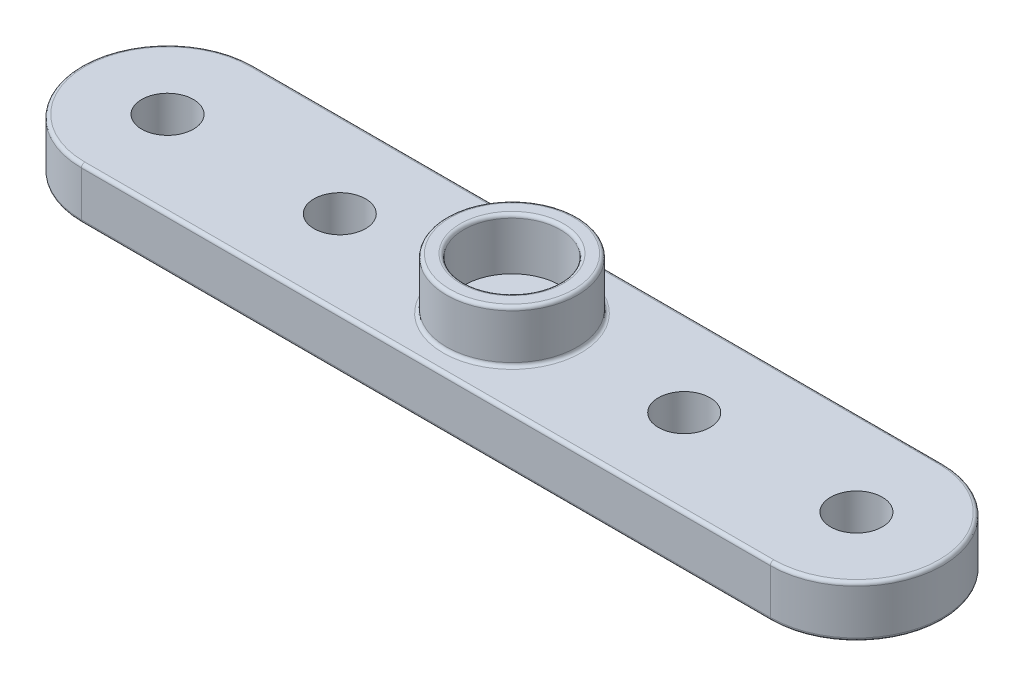
from build123d import *

# Parameters (mm, degrees)
SKETCH1_W           = 50
SKETCH1_H           = 10
SKETCH1_R           = 1.5
BOSS_EXTRUDE1_DEPTH = 3
FILLET2_RADIUS      = 5
FILLET2_LENGTH      = 3
FILLET3_RADIUS      = 5
FILLET3_LENGTH      = 3
SKETCH2_R           = 3.8
SKETCH2_R_2         = 2.8
BOSS_EXTRUDE2_DEPTH = 3
FILLET4_R           = 0.2


with BuildPart() as part:
    # Sketch1 → Boss-Extrude1 (new body)
    with BuildSketch(Plane(origin=(0, 0, 0), x_dir=(1, 0, 0), z_dir=(0, 1, 0))):
        Rectangle(SKETCH1_W, SKETCH1_H)
        with Locations(Location((-20, 0, 0), (0, 0, 270))):
            Circle(SKETCH1_R, mode=Mode.SUBTRACT)
        with Locations(Location((-10, 0, 0), (0, 0, 270))):
            Circle(SKETCH1_R, mode=Mode.SUBTRACT)
        with Locations(Location((10, 0, 0), (0, 0, 90))):
            Circle(SKETCH1_R, mode=Mode.SUBTRACT)
        with Locations(Location((20, 0, 0), (0, 0, 90))):
            Circle(SKETCH1_R, mode=Mode.SUBTRACT)
    extrude(amount=BOSS_EXTRUDE1_DEPTH)

    # Fillet2: full round fillet: the end face becomes a half cylinder, R = half its width
    fillet2_face = Plane((-25, 1.5, 0), x_dir=(0, -1, 0), z_dir=(-1, 0, 0))  # on the end face: x along it, z out of the body
    fillet2_slab = fillet2_face.offset(-FILLET2_RADIUS / 2) * Box(FILLET2_LENGTH, 2 * FILLET2_RADIUS, FILLET2_RADIUS, mode=Mode.PRIVATE)  # the body's end, R deep
    fillet2_round = Plane((-20, 1.5, 0), x_dir=(-1, 0, 0), z_dir=(0, -1, 0)) * Cylinder(FILLET2_RADIUS, FILLET2_LENGTH, mode=Mode.PRIVATE)  # its axis R under the face
    add(fillet2_slab - fillet2_round, mode=Mode.SUBTRACT)

    # Fillet3: full round fillet: the end face becomes a half cylinder, R = half its width
    fillet3_face = Plane((25, 1.5, 0), x_dir=(0, 1, 0), z_dir=(1, 0, 0))  # on the end face: x along it, z out of the body
    fillet3_slab = fillet3_face.offset(-FILLET3_RADIUS / 2) * Box(FILLET3_LENGTH, 2 * FILLET3_RADIUS, FILLET3_RADIUS, mode=Mode.PRIVATE)  # the body's end, R deep
    fillet3_round = Plane((20, 1.5, 0), x_dir=(1, 0, 0), z_dir=(0, 1, 0)) * Cylinder(FILLET3_RADIUS, FILLET3_LENGTH, mode=Mode.PRIVATE)  # its axis R under the face
    add(fillet3_slab - fillet3_round, mode=Mode.SUBTRACT)

    # Sketch2 → Boss-Extrude2 (add)
    with BuildSketch(Plane(origin=(0, 3, 0), x_dir=(1, 0, 0), z_dir=(0, 1, 0))):
        with Locations(Location((0, 0, 0), (0, 0, 270))):
            Circle(SKETCH2_R)
        with Locations(Location((0, 0, 0), (0, 0, 270))):
            Circle(SKETCH2_R_2, mode=Mode.SUBTRACT)
    extrude(amount=BOSS_EXTRUDE2_DEPTH)

    # Fillet4
    fillet4_edges = [part.edges().sort_by_distance(p)[0] for p in [
        (0, 0, 5),
        (0, 3, 5),
        (-25, 0, 0),
        (-25, 3, 0),
        (0, 0, -5),
        (0, 3, -5),
        (25, 0, 0),
        (25, 3, 0),
        (0, 6, -3.8),
        (0, 3, -3.8),
        (0, 6, -2.8),
    ]]
    fillet(fillet4_edges, radius=FILLET4_R)


solid = part.part
